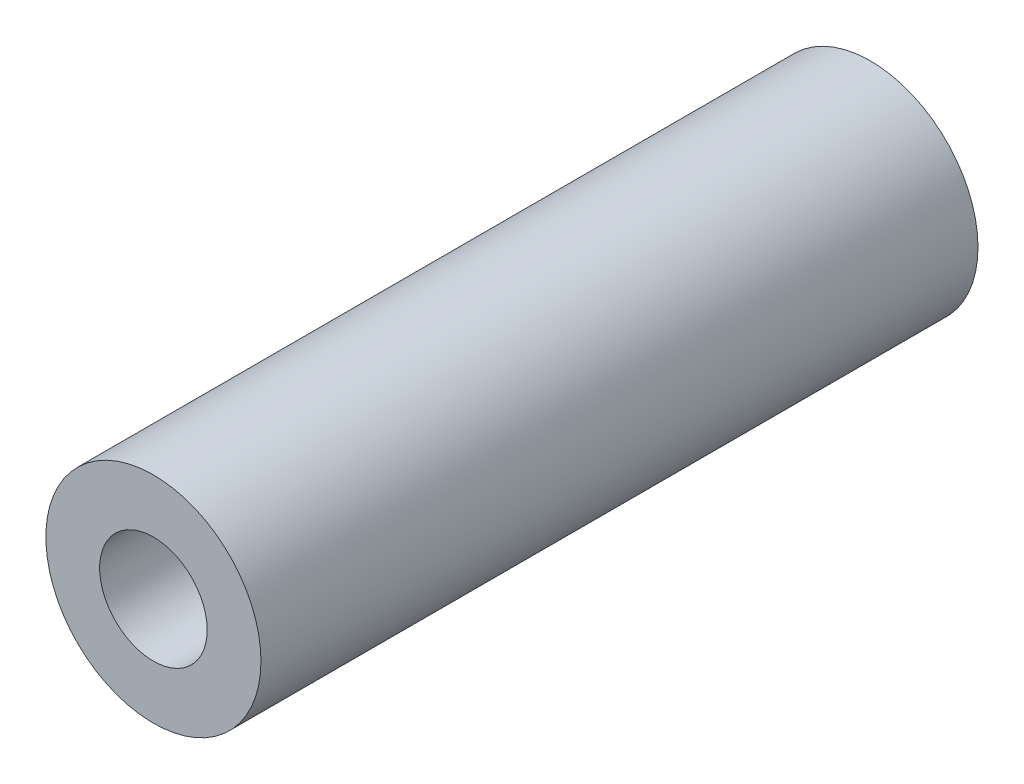
from build123d import *

# Parameters (mm, degrees)
SKETCH1_R           = 3
BOSS_EXTRUDE1_DEPTH = 20
SKETCH2_R           = 1.5
CUT_EXTRUDE1_DEPTH  = 3
CUT_EXTRUDE2_START  = -3
SKETCH3_R           = 1.5
CUT_EXTRUDE2_DEPTH  = 3


with BuildPart() as part:
    # Sketch1 → Boss-Extrude1 (new body)
    with BuildSketch(Plane.XY):
        Circle(SKETCH1_R)
    extrude(amount=BOSS_EXTRUDE1_DEPTH)

    # Sketch2 → Cut-Extrude1 (cut)
    with BuildSketch(Plane.XY.offset(20)):
        Circle(SKETCH2_R)
    extrude(amount=-CUT_EXTRUDE1_DEPTH, mode=Mode.SUBTRACT)

    # Sketch3 → Cut-Extrude2 (cut)
    with BuildSketch(Plane(origin=(0, 0, 0), x_dir=(-1, 0, 0), z_dir=(0, 0, -1)).offset(CUT_EXTRUDE2_START)):
        with Locations(Location((0, 0, 0), (0, 0, 180))):
            Circle(SKETCH3_R)
    extrude(amount=CUT_EXTRUDE2_DEPTH, mode=Mode.SUBTRACT)


solid = part.part
